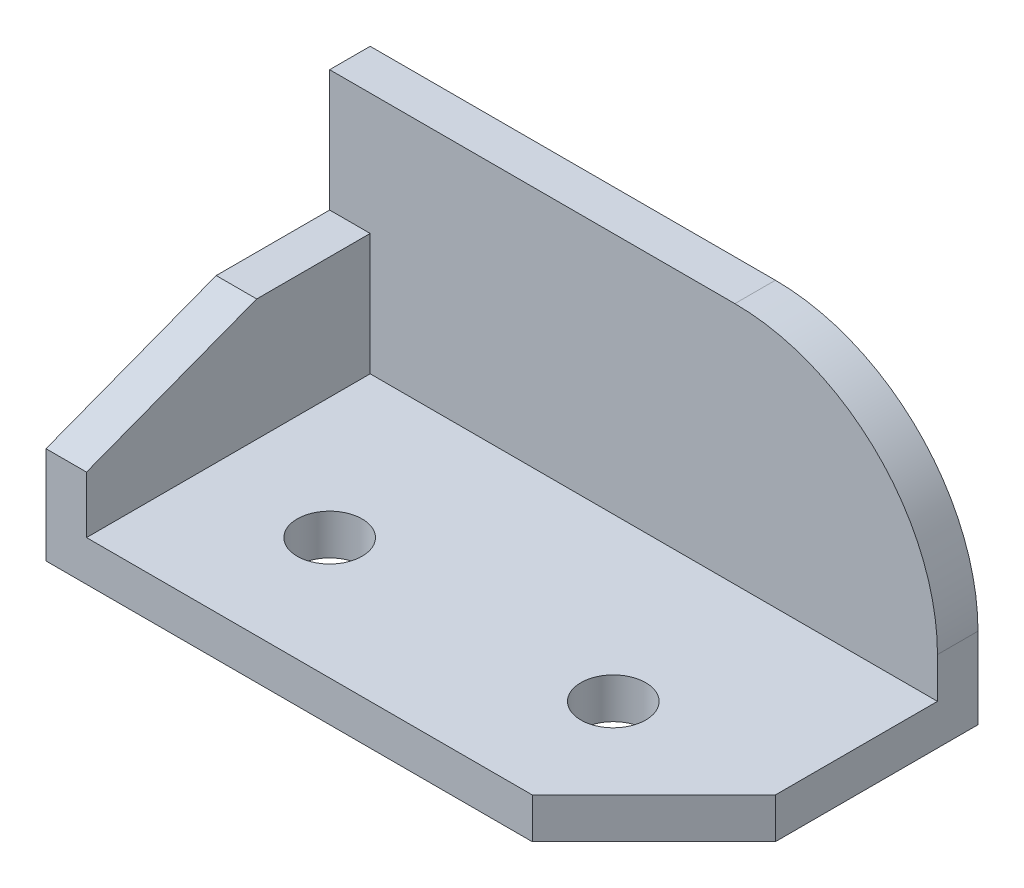
from build123d import *

# Parameters (mm, degrees)
SKETCH1_R           = 4
BOSS_EXTRUDE1_DEPTH = 5
BOSS_EXTRUDE2_DEPTH = 35
SKETCH1_4_W         = 5
SKETCH1_4_H         = 35
BOSS_EXTRUDE3_DEPTH = 20
CHAMFER1_SIZE       = 8
CHAMFER1_SIZE2      = 21
FILLET1_R           = 25


with BuildPart() as part:
    # Sketch1 → Boss-Extrude1 (new body)
    with BuildSketch(Plane(origin=(0, 0, 0), x_dir=(1, 0, 0), z_dir=(0, 1, 0))):
        Polygon((5, -5), (5, -40), (60, -40), (75, -25), (75, -5), align=None)
        with Locations((20, -25)):
            Circle(SKETCH1_R, mode=Mode.SUBTRACT)
        with Locations((55, -25)):
            Circle(SKETCH1_R, mode=Mode.SUBTRACT)
    extrude(amount=BOSS_EXTRUDE1_DEPTH)

    # Sketch1<3> → Boss-Extrude2 (add)
    with BuildSketch(Plane(origin=(0, 0, 0), x_dir=(1, 0, 0), z_dir=(0, 1, 0))):
        Polygon((0, -5), (5, -5), (75, -5), (75, 0), (0, 0), align=None)
    extrude(amount=BOSS_EXTRUDE2_DEPTH)

    # Sketch1<4> → Boss-Extrude3 (add)
    with BuildSketch(Plane(origin=(0, 0, 0), x_dir=(1, 0, 0), z_dir=(0, 1, 0))):
        with Locations((2.5, -22.5)):
            Rectangle(SKETCH1_4_W, SKETCH1_4_H)
    extrude(amount=BOSS_EXTRUDE3_DEPTH)

    # Chamfer1
    chamfer1_edges = [part.edges().sort_by_distance(p)[0] for p in [
        (2.5, 20, 40),
    ]]
    chamfer1_side = [part.faces().sort_by_distance(p)[0] for p in [
        (24.5, 4.5, 40),
    ]]
    chamfer(chamfer1_edges, length=CHAMFER1_SIZE, length2=CHAMFER1_SIZE2, reference=chamfer1_side[0])

    # Fillet1
    fillet1_edges = [part.edges().sort_by_distance(p)[0] for p in [
        (75, 35, 2.5),
    ]]
    fillet(fillet1_edges, radius=FILLET1_R)


solid = part.part
